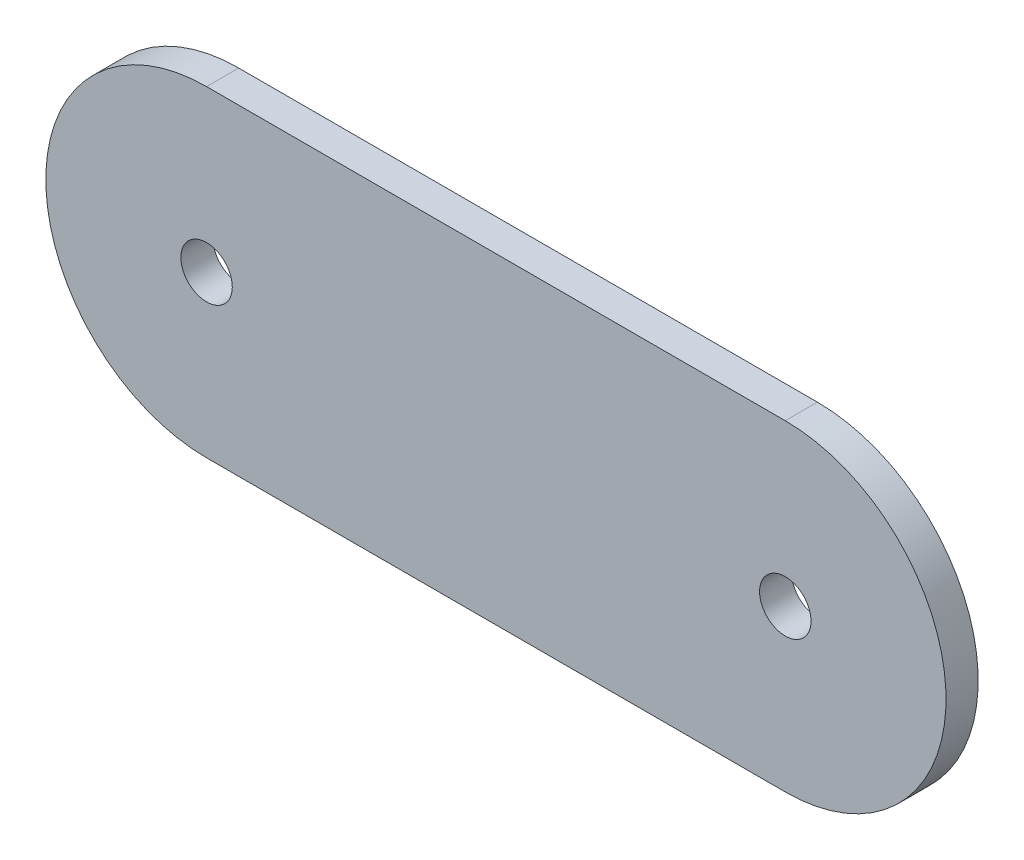
from build123d import *

# Parameters (mm, degrees)
SKETCH1_R           = 2
BOSS_EXTRUDE1_DEPTH = 2.5


with BuildPart() as part:
    # Sketch1 → Boss-Extrude1 (new body)
    with BuildSketch(Plane.XY):
        with BuildLine():
            Line((-29.199936565, 12.5), (15.800063435, 12.5))
            ThreePointArc((15.800063435, 12.5), (28.300063435, 0), (15.800063435, -12.5))
            Line((15.800063435, -12.5), (-29.199936565, -12.5))
            ThreePointArc((-29.199936565, -12.5), (-41.699936565, 0), (-29.199936565, 12.5))
        make_face()
        with Locations((-29.199936565, 0)):
            Circle(SKETCH1_R, mode=Mode.SUBTRACT)
        with Locations((15.800063435, 0)):
            Circle(SKETCH1_R, mode=Mode.SUBTRACT)
    extrude(amount=BOSS_EXTRUDE1_DEPTH)


solid = part.part
